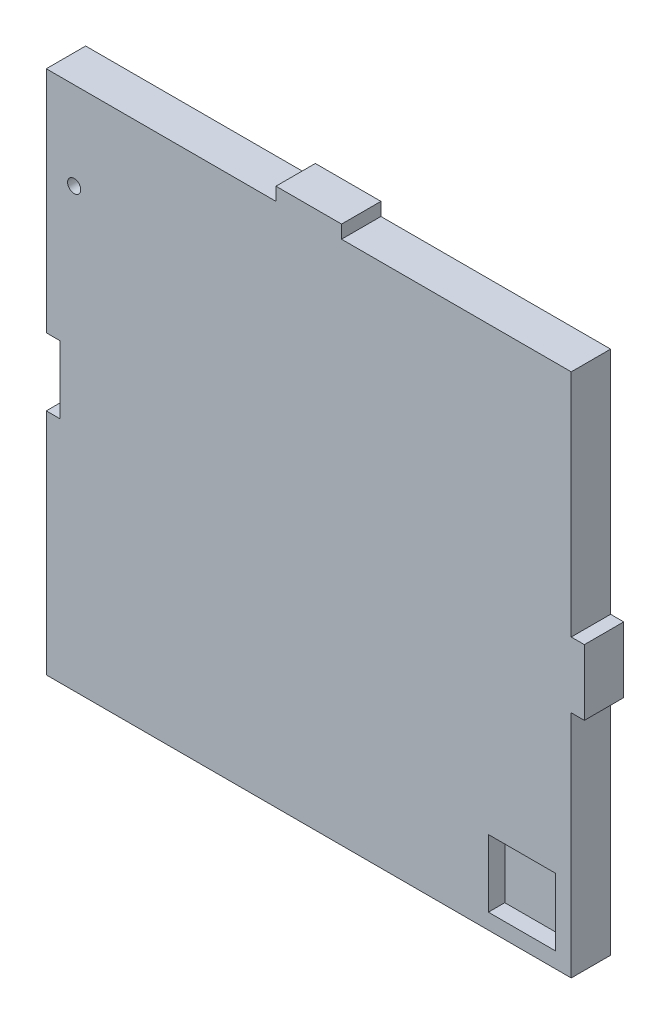
from build123d import *

# Parameters (mm, degrees)
SKETCH1_R           = 2
BOSS_EXTRUDE1_DEPTH = 12
SKETCH2_W           = 20.5
SKETCH2_H           = 20.5
CUT_EXTRUDE1_DEPTH  = 5
SKETCH3_R           = 3.45
CUT_EXTRUDE2_DEPTH  = 8


with BuildPart() as part:
    # Sketch1 → Boss-Extrude1 (new body)
    with BuildSketch(Plane.XY):
        Polygon((0, 0), (69.7, 0), (90.3, 0), (160, 0), (160, 70), (164, 70), (164, 90), (160, 90), (160, 160), (90, 160), (90, 164), (70, 164), (70, 160), (0, 160), (0, 90.3), (4.2, 90.3), (4.2, 69.7), (0, 69.7), align=None)
        with Locations((8.5, 133.3)):
            Circle(SKETCH1_R, mode=Mode.SUBTRACT)
    extrude(amount=BOSS_EXTRUDE1_DEPTH)

    # Sketch2 → Cut-Extrude1 (cut)
    with BuildSketch(Plane.XY.offset(12)):
        with Locations((145, 15)):
            Rectangle(SKETCH2_W, SKETCH2_H)
    extrude(amount=-CUT_EXTRUDE1_DEPTH, mode=Mode.SUBTRACT)

    # Sketch3 → Cut-Extrude2 (cut)
    with BuildSketch(Plane(origin=(0, 0, 0), x_dir=(-1, 0, 0), z_dir=(0, 0, -1))):
        with Locations((-8.5, 133.3)):
            Circle(SKETCH3_R)
    extrude(amount=-CUT_EXTRUDE2_DEPTH, mode=Mode.SUBTRACT)


solid = part.part
